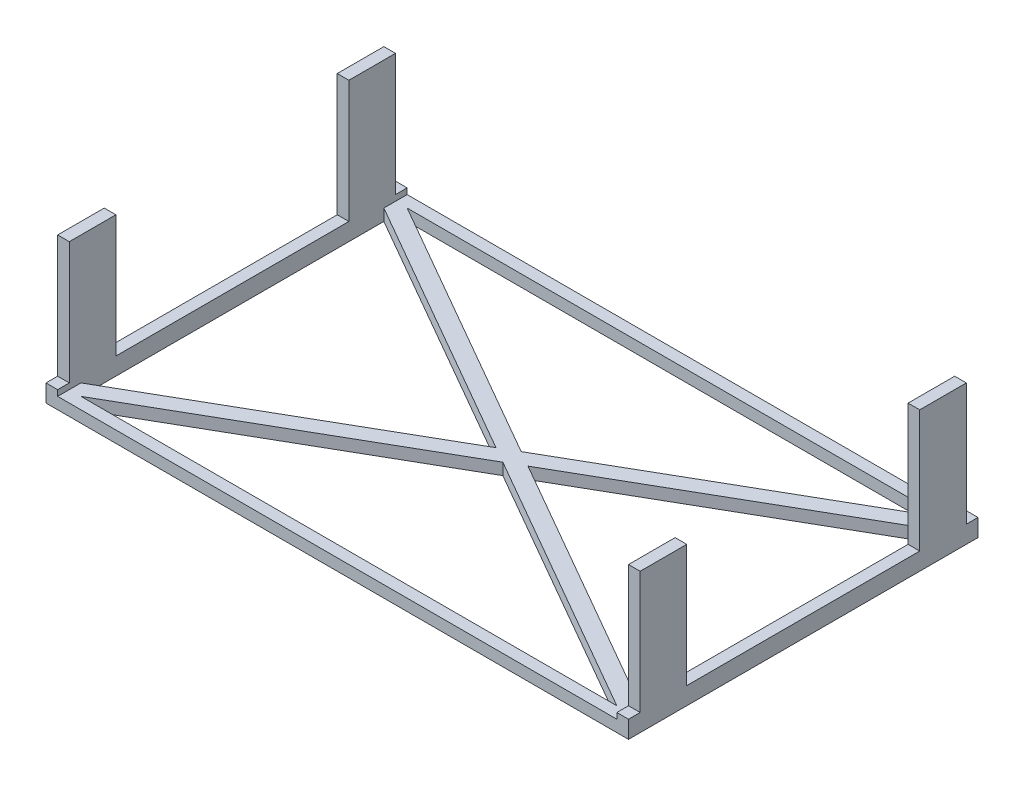
from build123d import *

# Parameters (mm, degrees)
BASE_W              = 500
BASE_H              = 300
EXTRUDE_1_DEPTH     = 120
SKETCH_1_W          = 480
SKETCH_1_H          = 110
CUT_EXTRUDE_1_DEPTH = 596.315042645
CUT_EXTRUDE_2_DEPTH = 596.315042645
SKETCH_3_W          = 200
SKETCH_3_H          = 105
SKETCH_3_W_2        = 10
CUT_EXTRUDE_3_DEPTH = 596.315042645


with BuildPart() as part:
    # base → 凸台-拉伸1 (new body)
    with BuildSketch(Plane(origin=(0, 0, 0), x_dir=(1, 0, 0), z_dir=(0, 1, 0))):
        with Locations((250, -150)):
            Rectangle(BASE_W, BASE_H)
    extrude(amount=EXTRUDE_1_DEPTH)

    # 草图1 → 切除-拉伸1 (cut, through all)
    with BuildSketch(Plane(origin=(0, 0, 0), x_dir=(-1, 0, 0), z_dir=(0, 0, -1))):
        with Locations((-250, 65)):
            Rectangle(SKETCH_1_W, SKETCH_1_H)
    extrude(amount=-CUT_EXTRUDE_1_DEPTH, mode=Mode.SUBTRACT)

    # 草图2 → 切除-拉伸2 (cut, through all)
    with BuildSketch(Plane.XZ):
        Polygon((10, 280), (10, 20), (236.296296296, 150), align=None)
        Polygon((20, 290), (480, 290), (250, 157.872340426), align=None)
        Polygon((263.703703704, 150), (490, 280), (490, 20), align=None)
        Polygon((250, 142.127659574), (20, 10), (480, 10), align=None)
    extrude(amount=-CUT_EXTRUDE_2_DEPTH, mode=Mode.SUBTRACT)

    # 草图3 → 切除-拉伸3 (cut, through all)
    with BuildSketch(Plane.ZY):
        with Locations((150, 67.5)):
            Rectangle(SKETCH_3_W, SKETCH_3_H)
        with Locations((5, 67.5)):
            Rectangle(SKETCH_3_W_2, SKETCH_3_H)
        with Locations((295, 67.5)):
            Rectangle(SKETCH_3_W_2, SKETCH_3_H)
    extrude(amount=-CUT_EXTRUDE_3_DEPTH, mode=Mode.SUBTRACT)


solid = part.part
